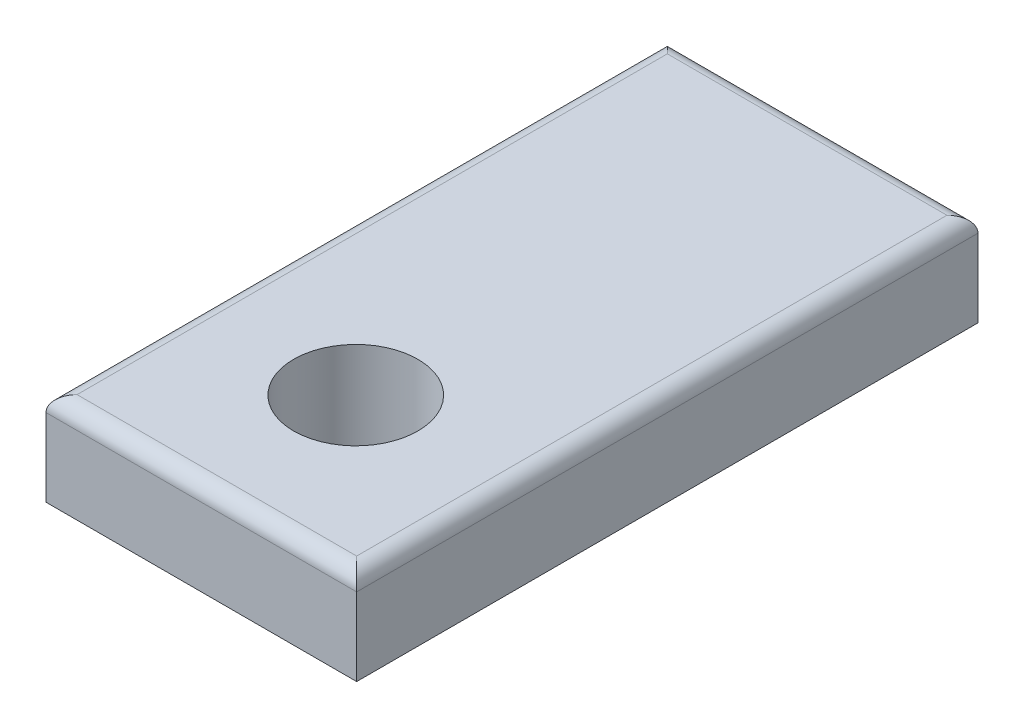
from build123d import *

# Parameters (mm, degrees)
SKETCH1_W           = 10
SKETCH1_H           = 20
BOSS_EXTRUDE1_DEPTH = 3
SKETCH2_R           = 2
CUT_EXTRUDE1_DEPTH  = 3
FILLET1_R           = 0.5


with BuildPart() as part:
    # Sketch1 → Boss-Extrude1 (new body)
    with BuildSketch(Plane(origin=(0, 0, 0), x_dir=(1, 0, 0), z_dir=(0, 1, 0))):
        Rectangle(SKETCH1_W, SKETCH1_H)
    extrude(amount=BOSS_EXTRUDE1_DEPTH)

    # Sketch2 → Cut-Extrude1 (cut)
    with BuildSketch(Plane(origin=(0, 3, 0), x_dir=(1, 0, 0), z_dir=(0, 1, 0))):
        with Locations(Location((0, -5.028947697, 0), (0, 0, 270))):
            Circle(SKETCH2_R)
    extrude(amount=-CUT_EXTRUDE1_DEPTH, mode=Mode.SUBTRACT)

    # Fillet1
    fillet1_edges = [part.edges().sort_by_distance(p)[0] for p in [
        (-5, 3, 0),
        (0, 3, 10),
        (5, 3, 0),
        (0, 3, -10),
    ]]
    fillet(fillet1_edges, radius=FILLET1_R)


solid = part.part
